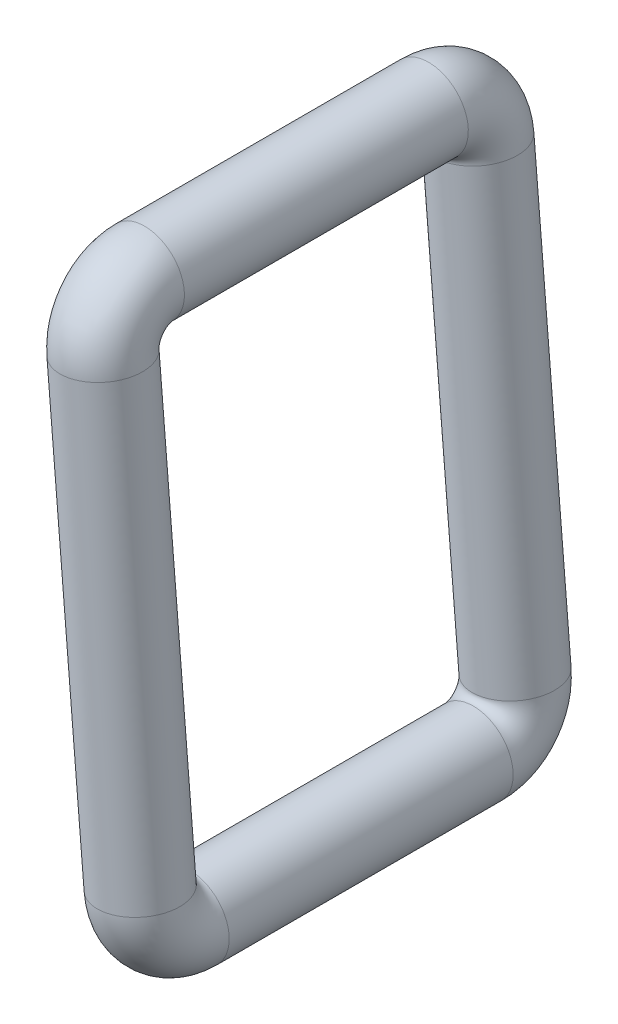
from build123d import *

# Parameters (mm, degrees)
SWEEP1_PROFILE_R = 0.7


with BuildPart() as part:
    # Sweep1: sweep along a path in Sketch1
    with BuildLine(Plane(origin=(11.661084527, -10.219427192, 0), x_dir=(-0.08342033512976119, 0.9965144493116187, 0), z_dir=(-0.9965144493116187, -0.08342033512976119, 0))) as sweep1_path:
        Line((1.598124117, 0), (9.455172114, 0))
        ThreePointArc((9.455172114, 0), (10.020857539, 0.234314575), (10.255172114, 0.8))
        Line((10.255172114, 0.8), (10.255172114, 5.8))
        ThreePointArc((10.255172114, 5.8), (10.020857539, 6.365685425), (9.455172114, 6.6))
        Line((9.455172114, 6.6), (1.598124117, 6.6))
        ThreePointArc((1.598124117, 6.6), (1.032438692, 6.365685425), (0.798124117, 5.8))
        Line((0.798124117, 5.8), (0.798124117, 0.8))
        ThreePointArc((0.798124117, 0.8), (1.032438692, 0.234314575), (1.598124117, 0))
    # Sweep1 profile (on start of the path) → Sweep1 (sweep)
    with BuildSketch(Plane(origin=(11.527768478, -8.626873418, 0), x_dir=(0.9965144493116187, 0.08342033512976119, 0), z_dir=(-0.08342033512976119, 0.9965144493116187, 0))):
        Circle(SWEEP1_PROFILE_R)
    sweep(path=sweep1_path.line)


solid = part.part
